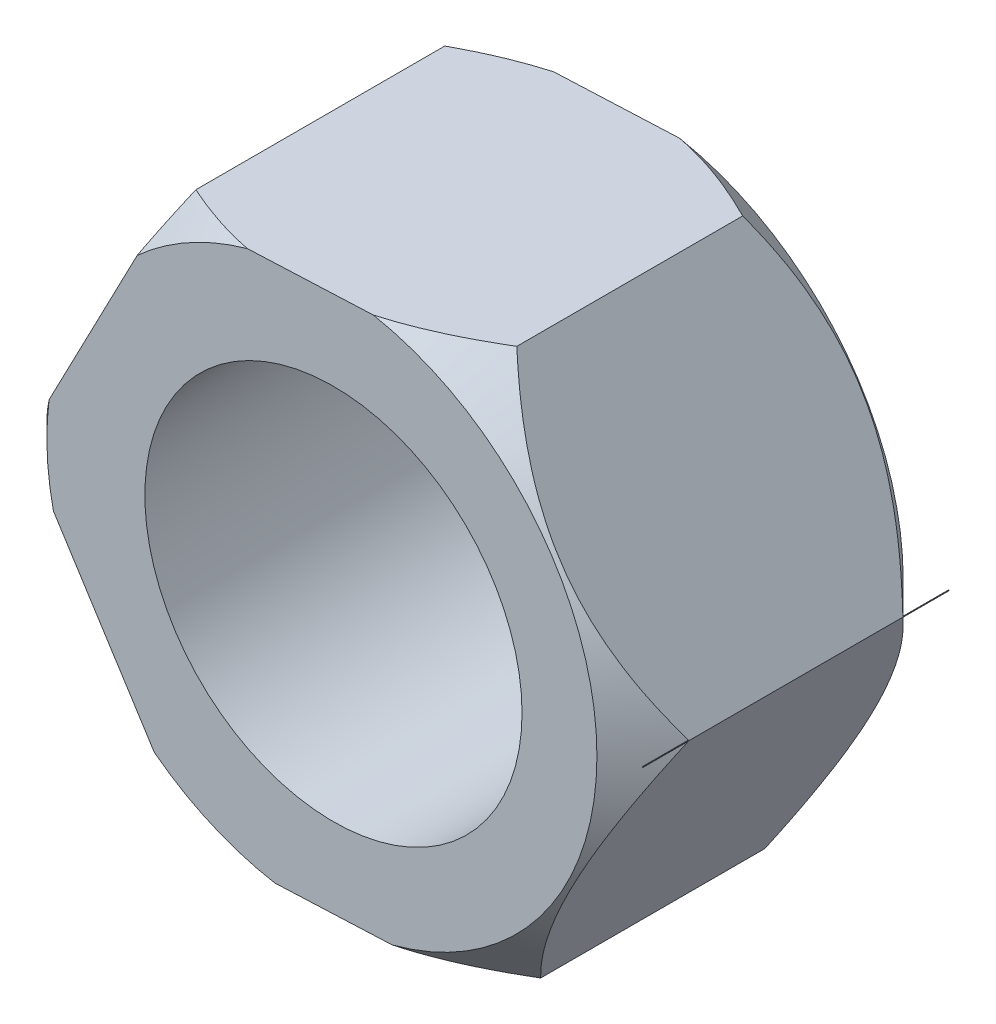
from build123d import *

# Parameters (mm, degrees)
SKETCH1_R           = 0.123170065
BOSS_EXTRUDE2_DEPTH = 0.2


with BuildPart() as part:
    # Sketch1 → Boss-Extrude2 (new body)
    with BuildSketch(Plane.XY):
        Polygon((-0.10857217, 0.170649162), (-0.202072594, -0.008701676), (-0.093500424, -0.179350838), (0.10857217, -0.170649162), (0.202072594, 0.008701676), (0.093500424, 0.179350838), align=None)
        Circle(SKETCH1_R, mode=Mode.SUBTRACT)
    extrude(amount=BOSS_EXTRUDE2_DEPTH)

    # Sketch3 → Cut-Revolve2 (revolve, cut)
    with BuildSketch(Plane(origin=(0, 0, 0), x_dir=(1, 0, 0), z_dir=(0, 1, 0))):
        Polygon((0.172072594, 0), (0.202072594, 0), (0.202072594, -0.03), align=None)
        Polygon((0.202072594, -0.2), (0.202072594, -0.17), (0.172072594, -0.2), align=None)
    revolve(axis=Axis((-0.007535873, 0, 0), (0, 0, 1)), mode=Mode.SUBTRACT)


solid = part.part
